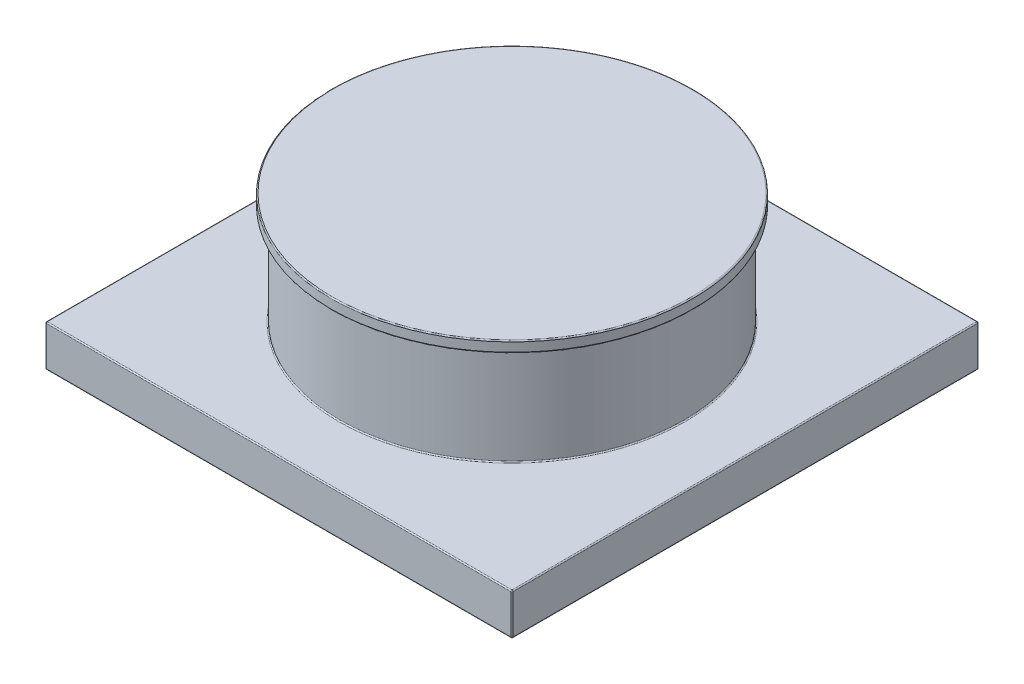
from build123d import *

# Parameters (mm, degrees)
SKETCH1_W           = 2100
SKETCH1_H           = 2100
BOSS_EXTRUDE1_DEPTH = 186
SKETCH2_R           = 775
BOSS_EXTRUDE2_DEPTH = 501
SKETCH3_R           = 813.34174717
BOSS_EXTRUDE3_DEPTH = 50
SKETCH4_R           = 12.5
CUT_EXTRUDE1_DEPTH  = 10
FILLET1_R           = 5


with BuildPart() as part:
    # Sketch1 → Boss-Extrude1 (new body)
    with BuildSketch(Plane(origin=(0, 0, 0), x_dir=(1, 0, 0), z_dir=(0, 1, 0))):
        with Locations((1050, 1050)):
            Rectangle(SKETCH1_W, SKETCH1_H)
    extrude(amount=BOSS_EXTRUDE1_DEPTH)

    # Sketch2 → Boss-Extrude2 (add)
    with BuildSketch(Plane(origin=(0, 186, 0), x_dir=(1, 0, 0), z_dir=(0, 1, 0))):
        with Locations(Location((1050, 1050, 0), (0, 0, 90))):
            Circle(SKETCH2_R)
    extrude(amount=BOSS_EXTRUDE2_DEPTH)

    # Sketch3 → Boss-Extrude3 (add)
    with BuildSketch(Plane(origin=(0, 687, 0), x_dir=(1, 0, 0), z_dir=(0, 1, 0))):
        with Locations(Location((1050, 1050, 0), (0, 0, 270))):
            Circle(SKETCH3_R)
    extrude(amount=-BOSS_EXTRUDE3_DEPTH)

    # Sketch4 → Cut-Extrude1 (cut)
    with BuildSketch(Plane.XZ):
        with Locations(Location((546.652032242, -600, 0), (0, 0, 270))):
            Circle(SKETCH4_R)
        with Locations(Location((1556.652032242, -600, 0), (0, 0, 270))):
            Circle(SKETCH4_R)
        with Locations(Location((546.652032242, -1500, 0), (0, 0, 270))):
            Circle(SKETCH4_R)
        with Locations(Location((1556.652032242, -1500, 0), (0, 0, 270))):
            Circle(SKETCH4_R)
    extrude(amount=-CUT_EXTRUDE1_DEPTH, mode=Mode.SUBTRACT)

    # Fillet1
    fillet1_edges = [part.edges().sort_by_distance(p)[0] for p in [
        (2100, 186, -1050),
        (1050, 186, -2100),
        (1050, 186, -275),
        (1050, 687, -1863.34174717),
        (1050, 637, -1863.34174717),
        (0, 186, -1050),
        (1050, 0, -2100),
        (2100, 0, -1050),
        (1050, 0, 0),
        (0, 0, -1050),
        (1050, 186, 0),
        (0, 93, -2100),
        (2100, 93, -2100),
        (2100, 93, 0),
        (0, 93, 0),
    ]]
    fillet(fillet1_edges, radius=FILLET1_R)


solid = part.part
